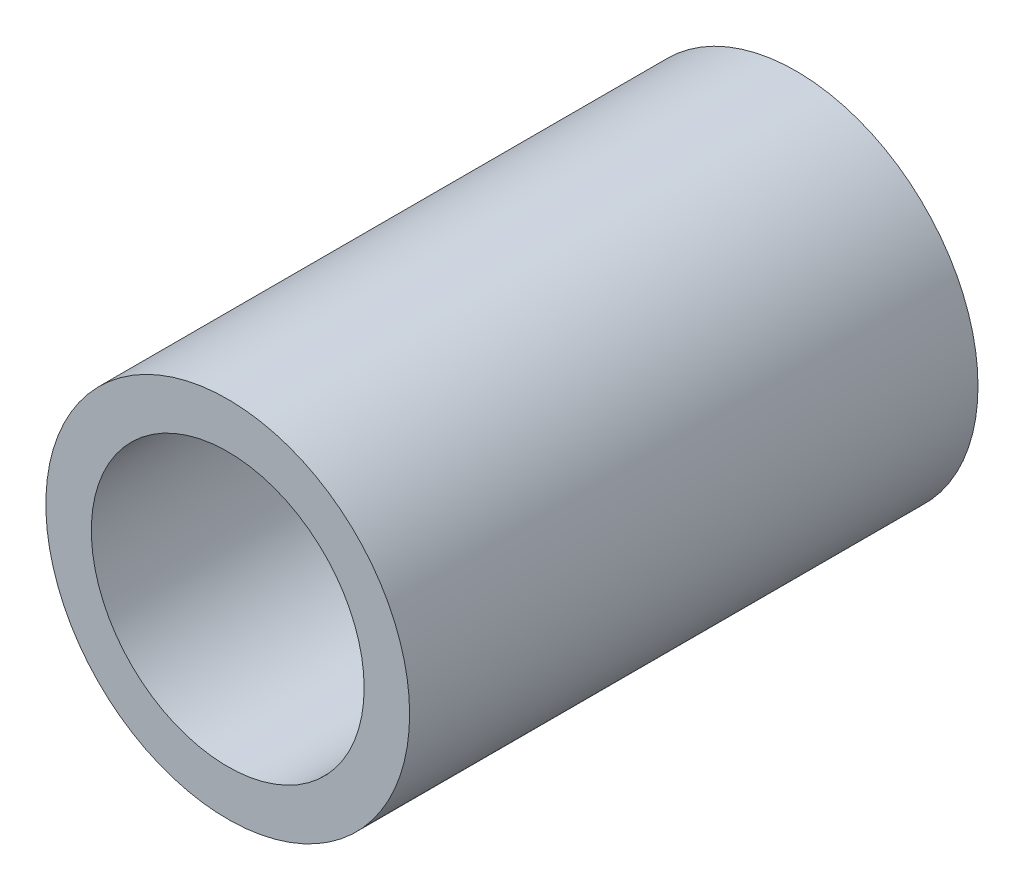
from build123d import *

# Parameters (mm, degrees)
ESBO_O1_R                = 8
ESBO_O1_R_2              = 6
RESSALTO_EXTRUS_O1_DEPTH = 25


with BuildPart() as part:
    # Esboço1 → Ressalto-extrusão1 (new body)
    with BuildSketch(Plane.XY):
        Circle(ESBO_O1_R)
        Circle(ESBO_O1_R_2, mode=Mode.SUBTRACT)
    extrude(amount=RESSALTO_EXTRUS_O1_DEPTH)


solid = part.part
